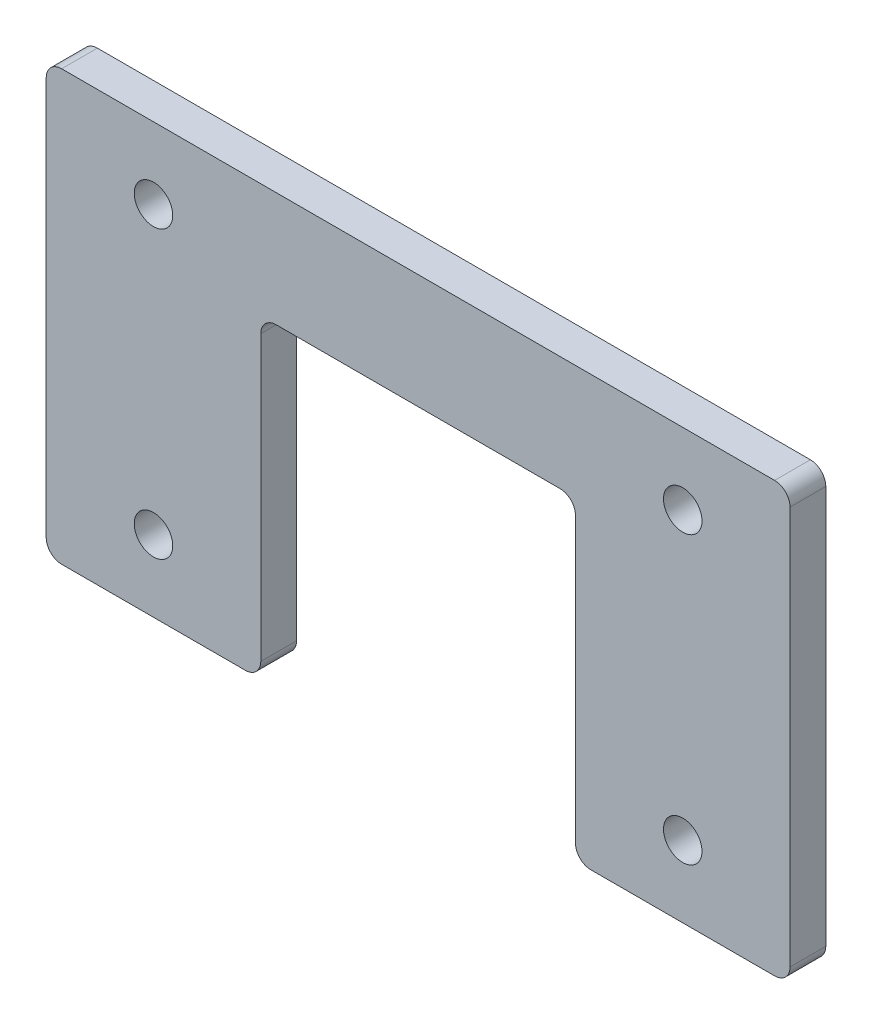
from build123d import *

# Parameters (mm, degrees)
SKETCH1_R           = 2.693094888
BOSS_EXTRUDE1_DEPTH = 5


with BuildPart() as part:
    # Sketch1 → Boss-Extrude1 (new body)
    with BuildSketch(Plane.XY):
        with BuildLine():
            Line((326.218649089, 421.822340311), (351.909697268, 421.822340311))
            ThreePointArc((351.909697268, 421.822340311), (353.433141794, 422.453371695), (354.064173178, 423.976816221))
            Line((354.064173178, 423.976816221), (354.064173178, 463.6678644))
            ThreePointArc((354.064173178, 463.6678644), (354.695204563, 465.191308926), (356.218649089, 465.822340311))
            Line((356.218649089, 465.822340311), (395.909699459, 465.822340311))
            ThreePointArc((395.909699459, 465.822340311), (397.433143985, 465.191308926), (398.064175369, 463.6678644))
            Line((398.064175369, 463.6678644), (398.064175369, 423.976816221))
            ThreePointArc((398.064175369, 423.976816221), (398.695206753, 422.453371695), (400.218651279, 421.822340311))
            Line((400.218651279, 421.822340311), (425.909697268, 421.822340311))
            ThreePointArc((425.909697268, 421.822340311), (427.433141794, 422.453371695), (428.064173178, 423.976816221))
            Line((428.064173178, 423.976816221), (428.064173178, 479.6678644))
            ThreePointArc((428.064173178, 479.6678644), (427.433141794, 481.191308926), (425.909697268, 481.822340311))
            Line((425.909697268, 481.822340311), (326.218649089, 481.822340311))
            ThreePointArc((326.218649089, 481.822340311), (324.695204563, 481.191308926), (324.064173178, 479.6678644))
            Line((324.064173178, 479.6678644), (324.064173178, 423.976816221))
            ThreePointArc((324.064173178, 423.976816221), (324.695204563, 422.453371695), (326.218649089, 421.822340311))
        make_face()
        with Locations((339.064173178, 471.822340311)):
            Circle(SKETCH1_R, mode=Mode.SUBTRACT)
        with Locations((339.064173178, 431.822340311)):
            Circle(SKETCH1_R, mode=Mode.SUBTRACT)
        with Locations((413.064174274, 431.822340311)):
            Circle(SKETCH1_R, mode=Mode.SUBTRACT)
        with Locations((413.064174274, 471.822340311)):
            Circle(SKETCH1_R, mode=Mode.SUBTRACT)
    extrude(amount=-BOSS_EXTRUDE1_DEPTH)


solid = part.part
